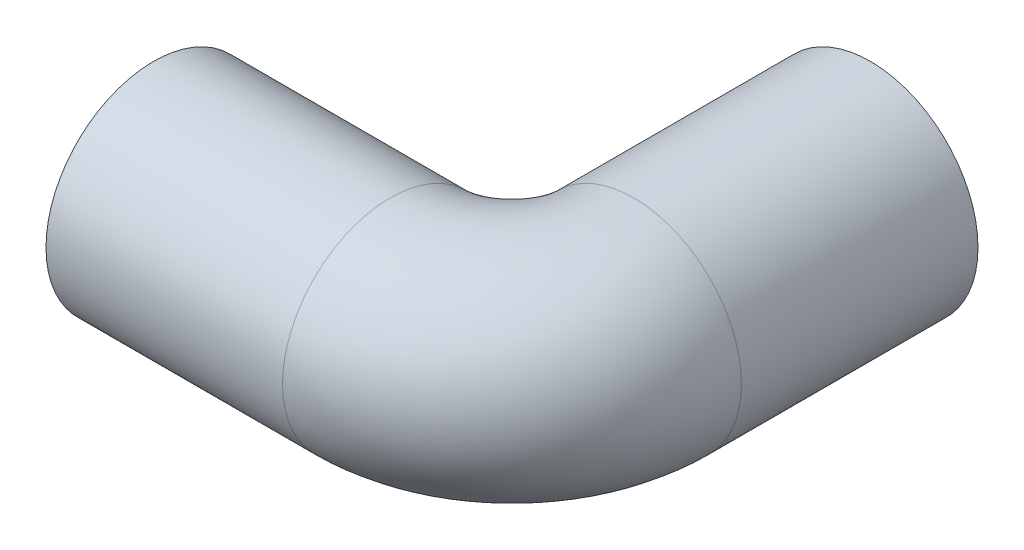
from build123d import *

# Parameters (mm, degrees)
SWEEP1_PROFILE_R = 15
SHELL1_T         = -2


with BuildPart() as part:
    # Sweep1: sweep along a path in Sketch1
    with BuildLine(Plane(origin=(0, 0, 0), x_dir=(1, 0, 0), z_dir=(0, 1, 0))) as sweep1_path:
        Line((-50, 0), (-17, 0))
        ThreePointArc((-17, 0), (-4.97918472, 4.97918472), (0, 17))
        Line((0, 17), (0, 50))
    # Sweep1 profile (on start of the path) → Sweep1 (sweep)
    with BuildSketch(Plane(origin=(-50, 0, 0), x_dir=(0, 0, 1), z_dir=(1, 0, 0))):
        Circle(SWEEP1_PROFILE_R)
    sweep(path=sweep1_path.line)

    # Shell1
    shell1_openings = [part.faces().sort_by_distance(p)[0] for p in [
        (0, 0, -50),
        (-50, 0, 0),
    ]]
    offset(amount=SHELL1_T, openings=shell1_openings, kind=Kind.INTERSECTION)


solid = part.part
